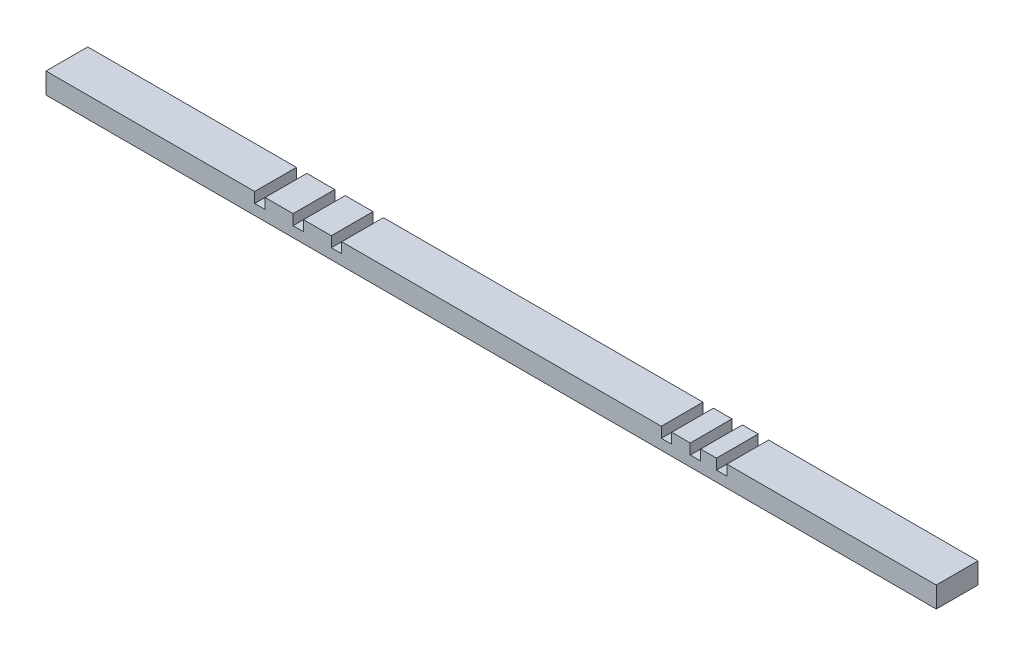
from build123d import *

# Parameters (mm, degrees)
SKETCH1_W           = 812.8
SKETCH1_H           = 38.1
BOSS_EXTRUDE1_DEPTH = 19.05
CUT_EXTRUDE3_DEPTH  = 9.525


with BuildPart() as part:
    # Sketch1 → Boss-Extrude1 (new body)
    with BuildSketch(Plane(origin=(0, 0, 0), x_dir=(1, 0, 0), z_dir=(0, 1, 0))):
        with Locations((406.4, -19.05)):
            Rectangle(SKETCH1_W, SKETCH1_H)
    extrude(amount=BOSS_EXTRUDE1_DEPTH)

    # Sketch2 → Cut-Extrude3 (cut)
    with BuildSketch(Plane(origin=(0, 19.05, 0), x_dir=(1, 0, 0), z_dir=(0, 1, 0))):
        Polygon((621.649258871, -19.05), (621.649258871, 0), (612.124258871, 0), (612.124258871, -19.05), (612.124258871, -38.1), (621.649258871, -38.1), align=None)
        Polygon((597.71307456, -19.05), (597.71307456, 0), (588.18807456, 0), (588.18807456, -19.05), (588.18807456, -38.1), (597.71307456, -38.1), align=None)
        Polygon((571.26745157, -19.05), (571.26745157, 0), (561.74245157, 0), (561.74245157, -19.05), (561.74245157, -38.1), (571.26745157, -38.1), align=None)
        Polygon((190.5, -19.05), (190.5, 0), (200.025, 0), (200.025, -19.05), (200.025, -38.1), (190.5, -38.1), align=None)
        Polygon((225.5404624, -19.05), (225.5404624, 0), (235.0654624, 0), (235.0654624, -38.1), (225.5404624, -38.1), align=None)
        Polygon((260.466704479, -19.05), (260.466704479, 0), (269.991704479, 0), (269.991704479, -38.1), (260.466704479, -38.1), align=None)
    extrude(amount=-CUT_EXTRUDE3_DEPTH, mode=Mode.SUBTRACT)


solid = part.part
